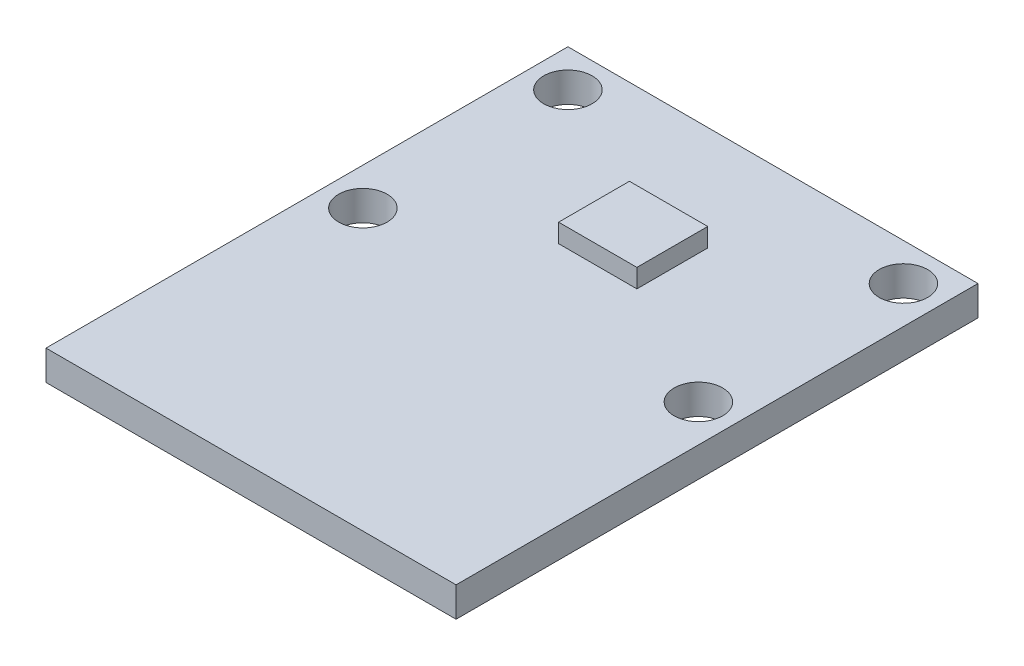
from build123d import *

# Parameters (mm, degrees)
SKETCH1_W           = 22
SKETCH1_H           = 28
SKETCH1_R           = 1.3
BOSS_EXTRUDE1_DEPTH = 1.6
SKETCH2_W           = 4.2
SKETCH2_H           = 3.8
BOSS_EXTRUDE2_DEPTH = 1


with BuildPart() as part:
    # Sketch1 → Boss-Extrude1 (new body)
    with BuildSketch(Plane(origin=(0, 0, 0), x_dir=(1, 0, 0), z_dir=(0, 1, 0))):
        with Locations((0, -6.5)):
            Rectangle(SKETCH1_W, SKETCH1_H)
        with Locations((9, 5.5)):
            Circle(SKETCH1_R, mode=Mode.SUBTRACT)
        with Locations((-9, 5.5)):
            Circle(SKETCH1_R, mode=Mode.SUBTRACT)
        with Locations((-9, -5.5)):
            Circle(SKETCH1_R, mode=Mode.SUBTRACT)
        with Locations((9, -5.5)):
            Circle(SKETCH1_R, mode=Mode.SUBTRACT)
    extrude(amount=BOSS_EXTRUDE1_DEPTH)

    # Sketch2 → Boss-Extrude2 (add)
    with BuildSketch(Plane(origin=(0, 1.6, 0), x_dir=(1, 0, 0), z_dir=(0, 1, 0))):
        Rectangle(SKETCH2_W, SKETCH2_H)
    extrude(amount=BOSS_EXTRUDE2_DEPTH)


solid = part.part
